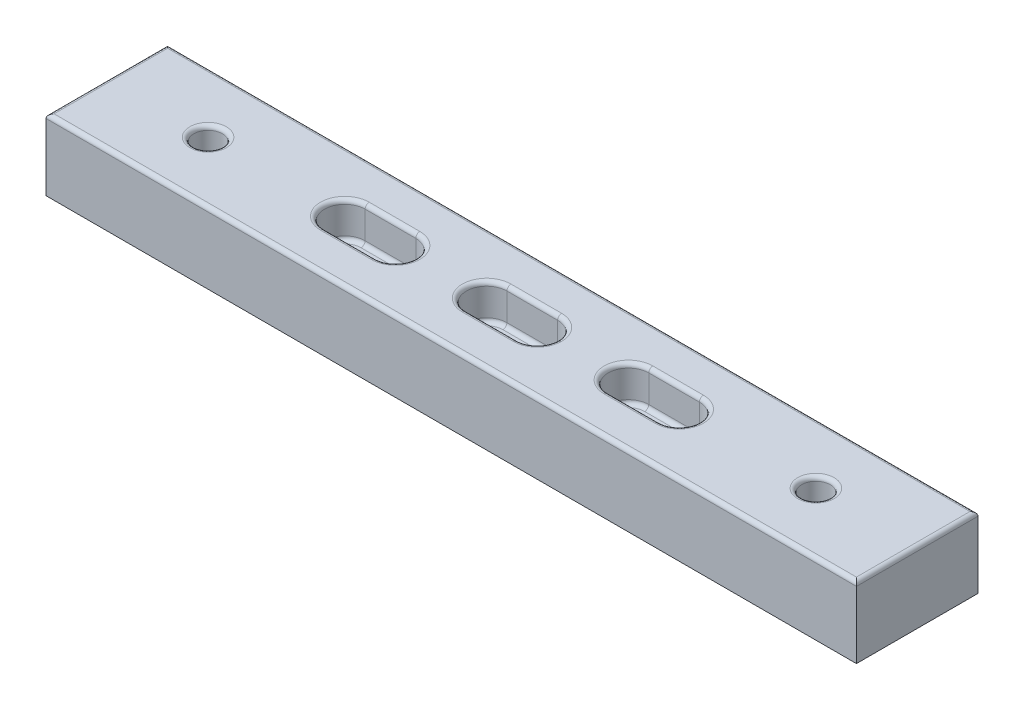
from build123d import *

# Parameters (mm, degrees)
SKETCH1_W                         = 400
SKETCH1_H                         = 60
BOSS_EXTRUDE1_DEPTH               = 35
SKETCH2_R                         = 7
CUT_EXTRUDE1_DEPTH                = 206.243757518
F_1_4_20_TAPPED_HOLE1_D           = 5.1054
F_1_4_20_TAPPED_HOLE1_DEPTH       = 18
F_1_4_20_TAPPED_HOLE1_CSINK_D     = 7.62
F_1_4_20_TAPPED_HOLE1_CSINK_ANGLE = 90
F_1_4_20_TAPPED_HOLE1_TIP         = 1.533816902
CUT_EXTRUDE4_DEPTH                = 17.5
FILLET1_R                         = 2


with BuildPart() as part:
    # Sketch1 → Boss-Extrude1 (new body)
    with BuildSketch(Plane(origin=(0, 0, 0), x_dir=(1, 0, 0), z_dir=(0, 1, 0))):
        Rectangle(SKETCH1_W, SKETCH1_H)
    extrude(amount=BOSS_EXTRUDE1_DEPTH)

    # Sketch2 → Cut-Extrude1 (cut, through all)
    with BuildSketch(Plane(origin=(0, 35, 0), x_dir=(1, 0, 0), z_dir=(0, 1, 0))):
        with Locations(Location((-150, 0, 0), (0, 0, 270))):
            Circle(SKETCH2_R)
        with Locations(Location((150, 0, 0), (0, 0, 270))):
            Circle(SKETCH2_R)
    extrude(amount=-CUT_EXTRUDE1_DEPTH, mode=Mode.SUBTRACT)

    # 1/4-20 Tapped Hole1
    with Locations(Plane.XZ):
        with Locations((-168.77, 18.77), (-131.23, 18.77), (-131.23, -18.77), (-168.77, -18.77), (131.23, 18.77), (168.77, 18.77), (168.77, -18.77), (131.23, -18.77)):
            CounterSinkHole(F_1_4_20_TAPPED_HOLE1_D / 2, F_1_4_20_TAPPED_HOLE1_CSINK_D / 2, depth=F_1_4_20_TAPPED_HOLE1_DEPTH, counter_sink_angle=F_1_4_20_TAPPED_HOLE1_CSINK_ANGLE)
            with Locations((0, 0, -(F_1_4_20_TAPPED_HOLE1_DEPTH + F_1_4_20_TAPPED_HOLE1_TIP / 2))):  # 118° drill point
                Cone(0, F_1_4_20_TAPPED_HOLE1_D / 2, F_1_4_20_TAPPED_HOLE1_TIP, mode=Mode.SUBTRACT)

    # Sketch10 → Cut-Extrude4 (cut)
    with BuildSketch(Plane(origin=(0, 35, 0), x_dir=(1, 0, 0), z_dir=(0, 1, 0))):
        with BuildLine():
            Line((-12.5, 10), (12.5, 10))
            ThreePointArc((12.5, 10), (22.5, 0), (12.5, -10))
            Line((12.5, -10), (-12.5, -10))
            ThreePointArc((-12.5, -10), (-22.5, 0), (-12.5, 10))
        make_face()
        with BuildLine():
            Line((57.5, 10), (82.5, 10))
            ThreePointArc((82.5, 10), (92.5, 0), (82.5, -10))
            Line((82.5, -10), (57.5, -10))
            ThreePointArc((57.5, -10), (47.5, 0), (57.5, 10))
        make_face()
        with BuildLine():
            Line((-82.5, 10), (-57.5, 10))
            ThreePointArc((-57.5, 10), (-47.5, 0), (-57.5, -10))
            Line((-57.5, -10), (-82.5, -10))
            ThreePointArc((-82.5, -10), (-92.5, 0), (-82.5, 10))
        make_face()
    extrude(amount=-CUT_EXTRUDE4_DEPTH, mode=Mode.SUBTRACT)

    # Fillet1
    fillet1_edges = [part.edges().sort_by_distance(p)[0] for p in [
        (-92.5, 17.5, 0),
        (-70, 17.5, -10),
        (-47.5, 17.5, 0),
        (-70, 17.5, 10),
        (-92.5, 35, 0),
        (-70, 35, 10),
        (-47.5, 35, 0),
        (-70, 35, -10),
        (47.5, 17.5, 0),
        (70, 17.5, -10),
        (92.5, 17.5, 0),
        (70, 17.5, 10),
        (47.5, 35, 0),
        (70, 35, 10),
        (92.5, 35, 0),
        (70, 35, -10),
        (-200, 35, 0),
        (-22.5, 17.5, 0),
        (0, 17.5, -10),
        (22.5, 17.5, 0),
        (0, 17.5, 10),
        (-22.5, 35, 0),
        (0, 35, 10),
        (22.5, 35, 0),
        (0, 35, -10),
        (0, 35, 30),
        (-150, 35, -7),
        (150, 35, -7),
        (200, 35, 0),
        (0, 35, -30),
    ]]
    fillet(fillet1_edges, radius=FILLET1_R)


solid = part.part
